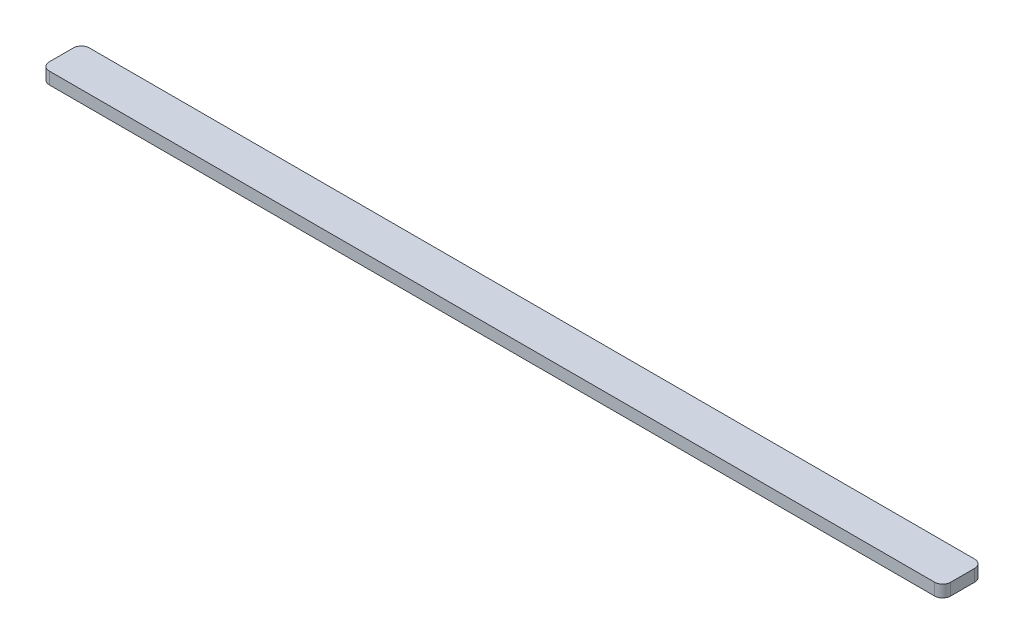
from build123d import *

# Parameters (mm, degrees)
SKETCH_1_W      = 225
SKETCH_1_H      = 10
EXTRUDE_1_DEPTH = 3
FILLET_1_R      = 2


with BuildPart() as part:
    # 스케치1 → 보스-돌출1 (new body)
    with BuildSketch(Plane(origin=(0, 0, 0), x_dir=(1, 0, 0), z_dir=(0, 1, 0))):
        with Locations((112.5, 5)):
            Rectangle(SKETCH_1_W, SKETCH_1_H)
    extrude(amount=EXTRUDE_1_DEPTH)

    # 필렛1
    fillet_1_edges = [part.edges().sort_by_distance(p)[0] for p in [
        (0, 1.5, -10),
        (225, 1.5, -10),
        (225, 1.5, 0),
        (0, 1.5, 0),
    ]]
    fillet(fillet_1_edges, radius=FILLET_1_R)


solid = part.part
